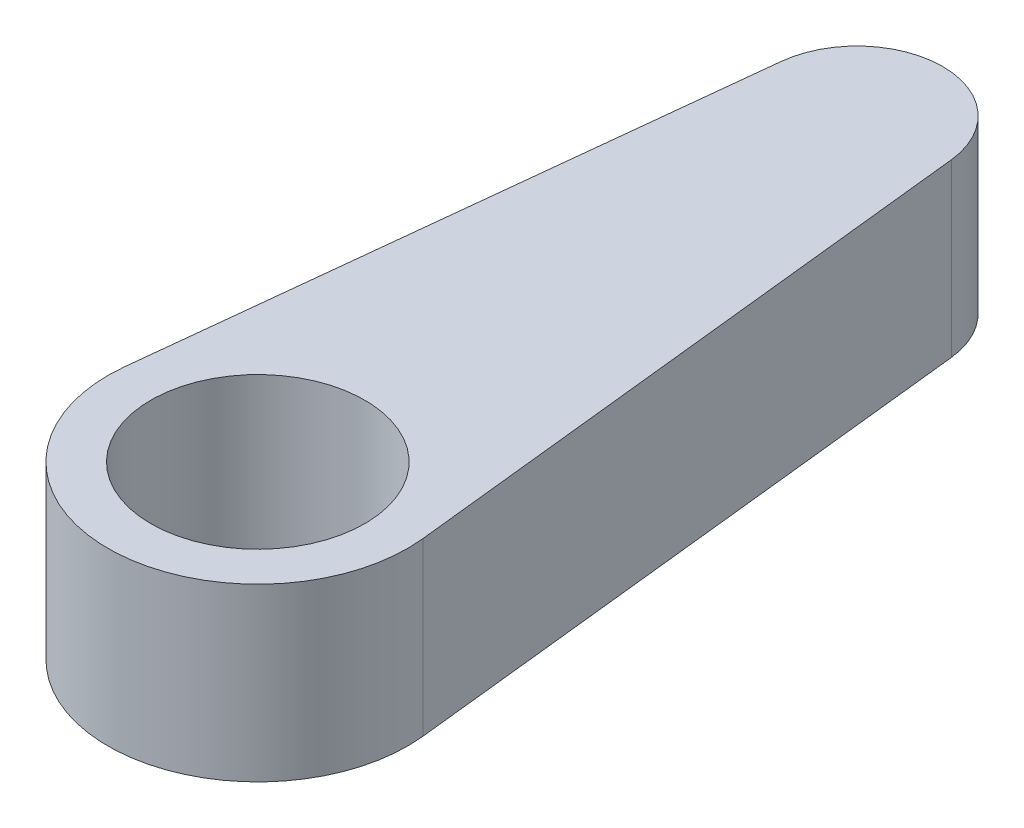
from build123d import *

# Parameters (mm, degrees)
EXTRUDE_1_DEPTH     = 4
CUT_EXTRUDE_1_REACH = 18.86
SKETCH_2_R          = 2.5


with BuildPart() as part:
    # 草图1 → 凸台-拉伸1 (new body)
    with BuildSketch(Plane(origin=(0, 0, 0), x_dir=(1, 0, 0), z_dir=(0, 1, 0))):
        with BuildLine():
            Line((3.479852727, 0.375), (1.988487272, 14.214285714))
            ThreePointArc((1.988487272, 14.214285714), (0, 16), (-1.988487272, 14.214285714))
            Line((-1.988487272, 14.214285714), (-3.479852727, 0.375))
            ThreePointArc((-3.479852727, 0.375), (0, -3.5), (3.479852727, 0.375))
        make_face()
    extrude(amount=EXTRUDE_1_DEPTH)

    # 草图2 → 切除-拉伸1 (cut, up to next)
    with BuildSketch(Plane(origin=(0, 4, 0), x_dir=(1, 0, 0), z_dir=(0, 1, 0)), mode=Mode.PRIVATE) as cut_extrude_1_sk1:
        with Locations(Location((0, 0, 0), (0, 0, 270))):
            Circle(SKETCH_2_R)
    cut_extrude_1_tool1 = extrude(cut_extrude_1_sk1.sketch, amount=-CUT_EXTRUDE_1_REACH, mode=Mode.PRIVATE) & part.part
    add(cut_extrude_1_tool1.solids().sort_by_distance((0, 4, 0))[0], mode=Mode.SUBTRACT)


solid = part.part
